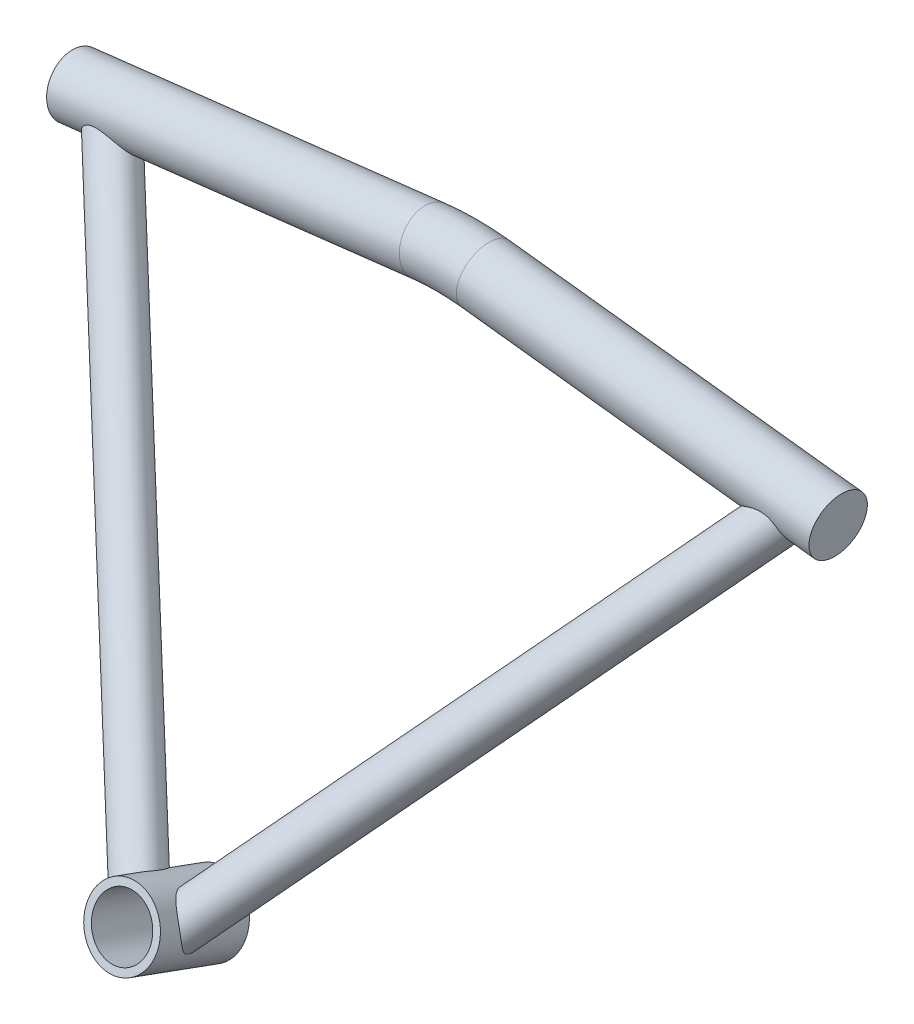
from build123d import *

# Parameters (mm, degrees)
SKETCH1_R               = 15.875
BOSS_EXTRUDE1_DEPTH     = 20.701
SWEEP1_PROFILE_R        = 9.525
SWEEP2_PROFILE_R        = 9.525
CUT_EXTRUDE2_REACH      = 385.588
SKETCH36_R              = 7.9375
CUT_EXTRUDE3_REACH      = 385.588
CUT_EXTRUDE3_END_RADIUS = 15.875
SKETCH37_R              = 7.9375
SKETCH77_R              = 15.875
BOSS_EXTRUDE2_DEPTH     = 41.402
CUT_EXTRUDE1_REACH      = 264.796
SKETCH2_R               = 12.7
SWEEP3_PROFILE_R        = 12.7


with BuildPart() as part:
    # Sketch1 → Boss-Extrude1 (new, symmetric)
    with BuildSketch(Plane(origin=(0, 0, 0), x_dir=(1, 0, 0), z_dir=(0, 0.34202014332566943, 0.9396926207859081))):
        with Locations(Location((0, 0, 0), (0, 0, 270))):
            Circle(SKETCH1_R)
    extrude(amount=BOSS_EXTRUDE1_DEPTH, both=True)

    # Sweep1: sweep along a path in Sketch4
    with BuildLine(Plane(origin=(0, 3.080688931, 3.943102019), x_dir=(1, 0, 0), z_dir=(0, 0.6156614753256595, 0.7880107536067211))) as sweep1_path:
        Line((-5.08, -3.909450368), (-147.114997482, 206.666093061))
    # Sweep1 profile (on start of the path) → Sweep1 (sweep)
    with BuildSketch(Plane(origin=(-5.08, 0, 6.35), x_dir=(0.7596990993440403, 0.6502747715049801, 0), z_dir=(-0.5591929034707481, 0.6532905223173845, -0.51040649501964))):
        Circle(SWEEP1_PROFILE_R)
    sweep(path=sweep1_path.line)

    # Sweep2: sweep along a path in Sketch15
    with BuildLine(Plane(origin=(0, 3.080688931, 3.943102019), x_dir=(1, 0, 0), z_dir=(0, 0.6156614753256595, 0.7880107536067211))) as sweep2_path:
        Line((5.08, -3.909450368), (147.114997482, 206.666093061))
    # Sweep2 profile (on start of the path) → Sweep2 (sweep)
    with BuildSketch(Plane(origin=(5.08, 0, 6.35), x_dir=(0.7596990993440405, -0.6502747715049798, 0), z_dir=(0.5591929034707479, 0.6532905223173846, -0.51040649501964))):
        Circle(SWEEP2_PROFILE_R)
    sweep(path=sweep2_path.line)

    # Sketch36 → Cut-Extrude2 (cut, up to next)
    with BuildSketch(Plane(origin=(-141.811107103, 165.674227364, -129.438892522), x_dir=(0.8288715932897402, 0.42824281146506227, -0.3599721881837912), z_dir=(-0.5591929034707481, 0.6532905223173845, -0.51040649501964)), mode=Mode.PRIVATE) as cut_extrude2_sk1:
        with Locations(Location((-6.496491089, -4.874853675, 0), (0, 0, 155.253466147))):
            Circle(SKETCH36_R)
    cut_extrude2_tool1 = extrude(cut_extrude2_sk1.sketch, amount=-CUT_EXTRUDE2_REACH, mode=Mode.PRIVATE) & part.part
    add(cut_extrude2_tool1.solids().sort_by_distance((-147.114997, 165.935793, -123.29325))[0], mode=Mode.SUBTRACT)

    # Cut-Extrude3: up to this cylinder (the profile starts outside it)
    cut_extrude3_end = Plane(origin=(0, -20.2148863, -55.539943646), z_dir=(0, -0.34202014332566943, -0.9396926207859081)) * Cylinder(CUT_EXTRUDE3_END_RADIUS, 803.926, mode=Mode.PRIVATE)
    # Sketch37 → Cut-Extrude3 (cut, up to the surface)
    with BuildSketch(Plane(origin=(141.811107103, 165.674227364, -129.438892522), x_dir=(0.8288715932897401, -0.4282428114650622, 0.3599721881837914), z_dir=(0.5591929034707481, 0.6532905223173843, -0.51040649501964)), mode=Mode.PRIVATE) as cut_extrude3_sk1:
        with Locations(Location((6.496491089, -4.874853675, 0), (0, 0, 204.746533853))):
            Circle(SKETCH37_R)
    cut_extrude3_tool1 = extrude(cut_extrude3_sk1.sketch, amount=-CUT_EXTRUDE3_REACH, mode=Mode.PRIVATE) - cut_extrude3_end
    add(cut_extrude3_tool1.solids().sort_by_distance((147.114997, 165.935793, -123.29325))[0], mode=Mode.SUBTRACT)

    # Sketch77 → Boss-Extrude2 (add)
    with BuildSketch(Plane(origin=(0, 7.080158987, 19.452576943), x_dir=(1, 0, 0), z_dir=(0, 0.34202014332566943, 0.9396926207859082))):
        with Locations(Location((0, 0, 0), (0, 0, 270))):
            Circle(SKETCH77_R)
    extrude(amount=-BOSS_EXTRUDE2_DEPTH)

    # Sketch2 → Cut-Extrude1 (cut, up to next)
    with BuildSketch(Plane(origin=(0, -7.080158987, -19.452576943), x_dir=(-1, 0, 0), z_dir=(0, -0.34202014332566943, -0.9396926207859081)), mode=Mode.PRIVATE) as cut_extrude1_sk1:
        with Locations(Location((0, 0, 0), (0, 0, 90))):
            Circle(SKETCH2_R)
    cut_extrude1_tool1 = extrude(cut_extrude1_sk1.sketch, amount=-CUT_EXTRUDE1_REACH, mode=Mode.PRIVATE) & part.part
    add(cut_extrude1_tool1.solids().sort_by_distance((0, -7.080159, -19.452577))[0], mode=Mode.SUBTRACT)

    # Sweep3: sweep along a path in Sketch40
    with BuildLine(Plane(origin=(-106.934, 0, -127), x_dir=(1, 0, 0), z_dir=(0, 0, 1))) as sweep3_path:
        Line((-59.730697815, 169.377458898), (94.482850096, 187.461060552))
        ThreePointArc((94.482850096, 187.461060552), (106.934, 188.1886), (119.385149904, 187.461060552))
        Line((119.385149904, 187.461060552), (273.598697815, 169.377458898))
    # Sweep3 profile (on start of the path) → Sweep3 (sweep)
    with BuildSketch(Plane(origin=(-166.664697815, 169.377458898, -127), x_dir=(-0.11646537232544882, 0.9931947528300251, 0), z_dir=(0.9931947528300251, 0.11646537232544882, 0))):
        Circle(SWEEP3_PROFILE_R)
    sweep(path=sweep3_path.line)


solid = part.part
